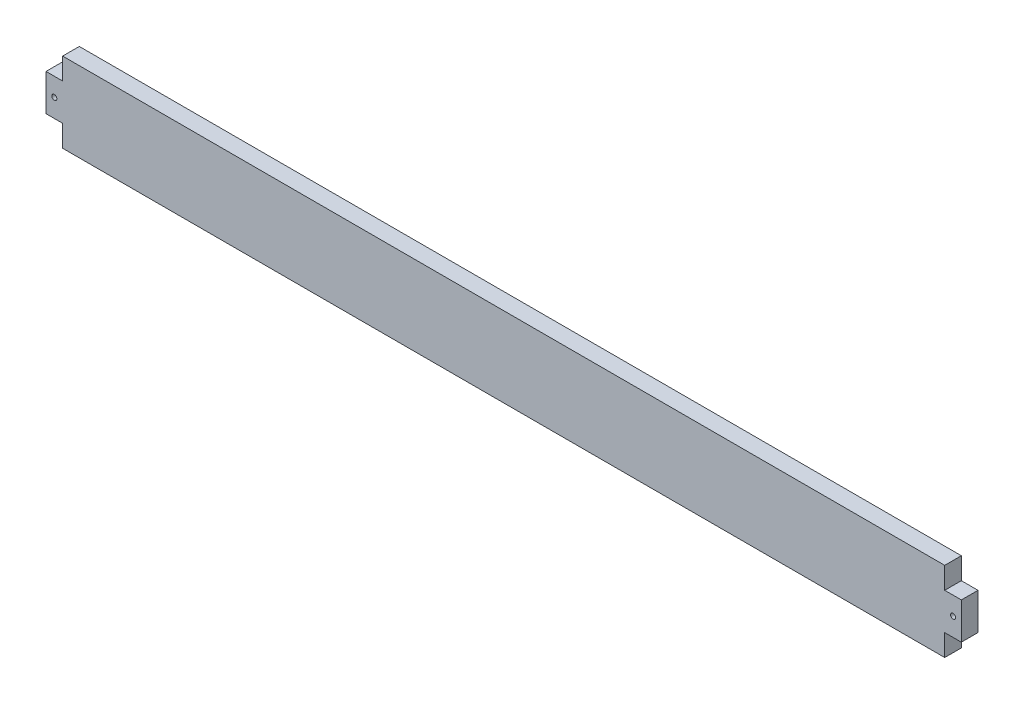
from build123d import *

# Parameters (mm, degrees)
SKETCH1_W             = 550
SKETCH1_H             = 48
EXTRUDE_361_DEPTH     = 10
CUT_EXTRUDE_622_REACH = 278.226
SKETCH2_W             = 10
SKETCH2_H             = 13
CUT_EXTRUDE_942_REACH = 278.226
SKETCH3_R             = 1.5


with BuildPart() as part:
    # Sketch1 → Extrude 361 (new body)
    with BuildSketch(Plane.XY):
        Rectangle(SKETCH1_W, SKETCH1_H)
    extrude(amount=EXTRUDE_361_DEPTH)

    # Sketch2 → Cut-Extrude 622 (cut, up to next)
    with BuildSketch(Plane.XY.offset(10), mode=Mode.PRIVATE) as cut_extrude_622_sk1:
        with Locations((-270, -17.5)):
            Rectangle(SKETCH2_W, SKETCH2_H)
    cut_extrude_622_tool1 = extrude(cut_extrude_622_sk1.sketch, amount=-CUT_EXTRUDE_622_REACH, mode=Mode.PRIVATE) & part.part
    # Sketch2 → Cut-Extrude 622 (cut, up to next)
    with BuildSketch(Plane.XY.offset(10), mode=Mode.PRIVATE) as cut_extrude_622_sk2:
        with Locations((-270, 17.5)):
            Rectangle(SKETCH2_W, SKETCH2_H)
    cut_extrude_622_tool2 = extrude(cut_extrude_622_sk2.sketch, amount=-CUT_EXTRUDE_622_REACH, mode=Mode.PRIVATE) & part.part
    cut_extrude_622_1 = cut_extrude_622_tool1.solids().sort_by_distance((-270, -17.5, 10))[0]
    add(cut_extrude_622_1, mode=Mode.SUBTRACT)
    cut_extrude_622_2 = cut_extrude_622_tool2.solids().sort_by_distance((-270, 17.5, 10))[0]
    add(cut_extrude_622_2, mode=Mode.SUBTRACT)
    cut_extrude_622 = cut_extrude_622_1 + cut_extrude_622_2  # Cut-Extrude 622 as one shape, for the pattern or mirror that repeats it

    # Sketch3 → Cut-Extrude 942 (cut, up to next)
    with BuildSketch(Plane.XY.offset(10), mode=Mode.PRIVATE) as cut_extrude_942_sk1:
        with Locations((-270, 0)):
            Circle(SKETCH3_R)
    cut_extrude_942_tool1 = extrude(cut_extrude_942_sk1.sketch, amount=-CUT_EXTRUDE_942_REACH, mode=Mode.PRIVATE) & part.part
    cut_extrude_942 = cut_extrude_942_tool1.solids().sort_by_distance((-270, 0, 10))[0]
    add(cut_extrude_942, mode=Mode.SUBTRACT)

    # Mirror1: Cut-Extrude 622, Cut-Extrude 942 across plane
    add(cut_extrude_622.mirror(Plane(origin=(0, 0, 0), x_dir=(0, 0, 1), z_dir=(1, 0, 0))), mode=Mode.SUBTRACT)
    add(cut_extrude_942.mirror(Plane(origin=(0, 0, 0), x_dir=(0, 0, 1), z_dir=(1, 0, 0))), mode=Mode.SUBTRACT)


solid = part.part
